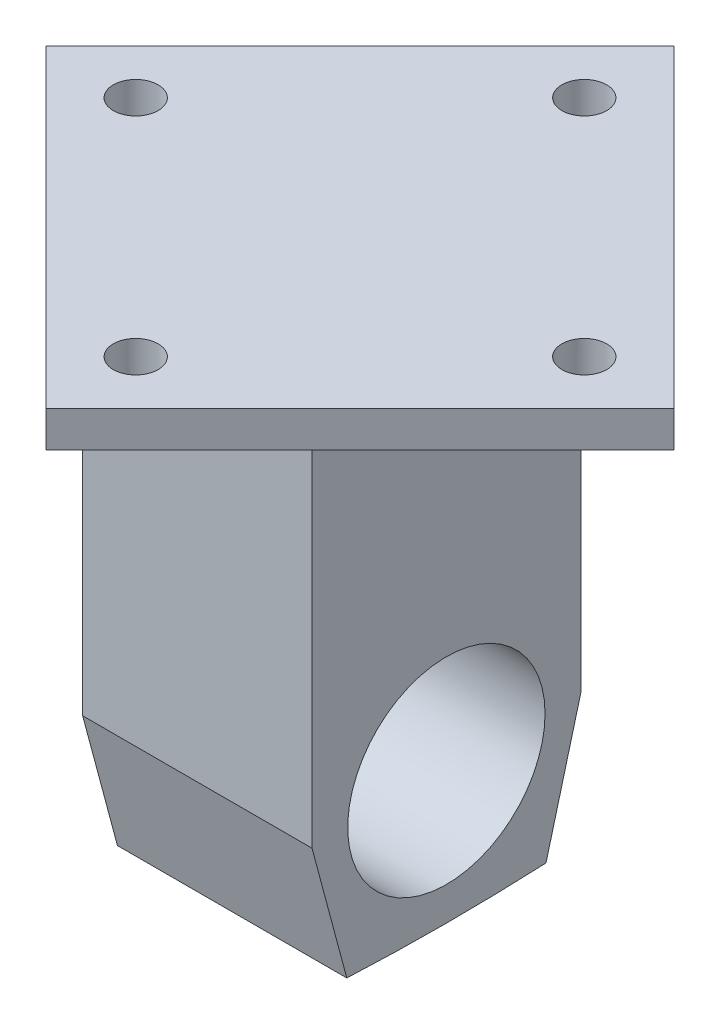
from build123d import *

# Parameters (mm, degrees)
SKETCH1_W           = 32.512
SKETCH1_H           = 38.1
BOSS_EXTRUDE1_DEPTH = 50.292
BOSS_EXTRUDE2_DEPTH = 32.512
SKETCH3_R           = 13.9871704
CUT_EXTRUDE1_DEPTH  = 127
BOSS_EXTRUDE3_DEPTH = 5.08
SKETCH5_R           = 3.175
CUT_EXTRUDE2_DEPTH  = 101.256951791


with BuildPart() as part:
    # Sketch1 → Boss-Extrude1 (new body)
    with BuildSketch(Plane(origin=(0, 0, 0), x_dir=(1, 0, 0), z_dir=(0, 1, 0))):
        Rectangle(SKETCH1_W, SKETCH1_H)
    extrude(amount=BOSS_EXTRUDE1_DEPTH)

    # Sketch2 → Boss-Extrude2 (add)
    with BuildSketch(Plane(origin=(16.256, 0, 0), x_dir=(0, 0, -1), z_dir=(1, 0, 0))):
        with BuildLine():
            Line((-19.05, 0), (-14.119497191, -18.400886991))
            ThreePointArc((-14.119497191, -18.400886991), (0, -18.733351542), (14.119497191, -18.400886991))
            Line((14.119497191, -18.400886991), (19.05, 0))
            Line((19.05, 0), (-19.05, 0))
        make_face()
    extrude(amount=-BOSS_EXTRUDE2_DEPTH)

    # Sketch3 → Cut-Extrude1 (cut)
    with BuildSketch(Plane(origin=(16.256, 0, 0), x_dir=(0, 0, -1), z_dir=(1, 0, 0))):
        Circle(SKETCH3_R)
    extrude(amount=-CUT_EXTRUDE1_DEPTH, mode=Mode.SUBTRACT)

    # Sketch4 → Boss-Extrude3 (add)
    with BuildSketch(Plane(origin=(0, 50.292, 0), x_dir=(1, 0, 0), z_dir=(0, 1, 0))):
        Polygon((-1.207933769, -39.277381208), (-45.702074629, 5.216759653), (-1.207933769, 49.710900513), (43.286207092, 5.216759653), align=None)
    extrude(amount=BOSS_EXTRUDE3_DEPTH)

    # Sketch5 → Cut-Extrude2 (cut, through all)
    with BuildSketch(Plane(origin=(0, 55.372, 0), x_dir=(1, 0, 0), z_dir=(0, 1, 0))):
        with Locations(Location((30.586207092, 5.216759653, 0), (0, 0, 270))):
            Circle(SKETCH5_R)
        with Locations(Location((-1.207933769, -26.577381208, 0), (0, 0, 270))):
            Circle(SKETCH5_R)
        with Locations(Location((-1.207933769, 37.010900513, 0), (0, 0, 90))):
            Circle(SKETCH5_R)
        with Locations(Location((-33.002074629, 5.216759653, 0), (0, 0, 90))):
            Circle(SKETCH5_R)
    extrude(amount=-CUT_EXTRUDE2_DEPTH, mode=Mode.SUBTRACT)


solid = part.part
